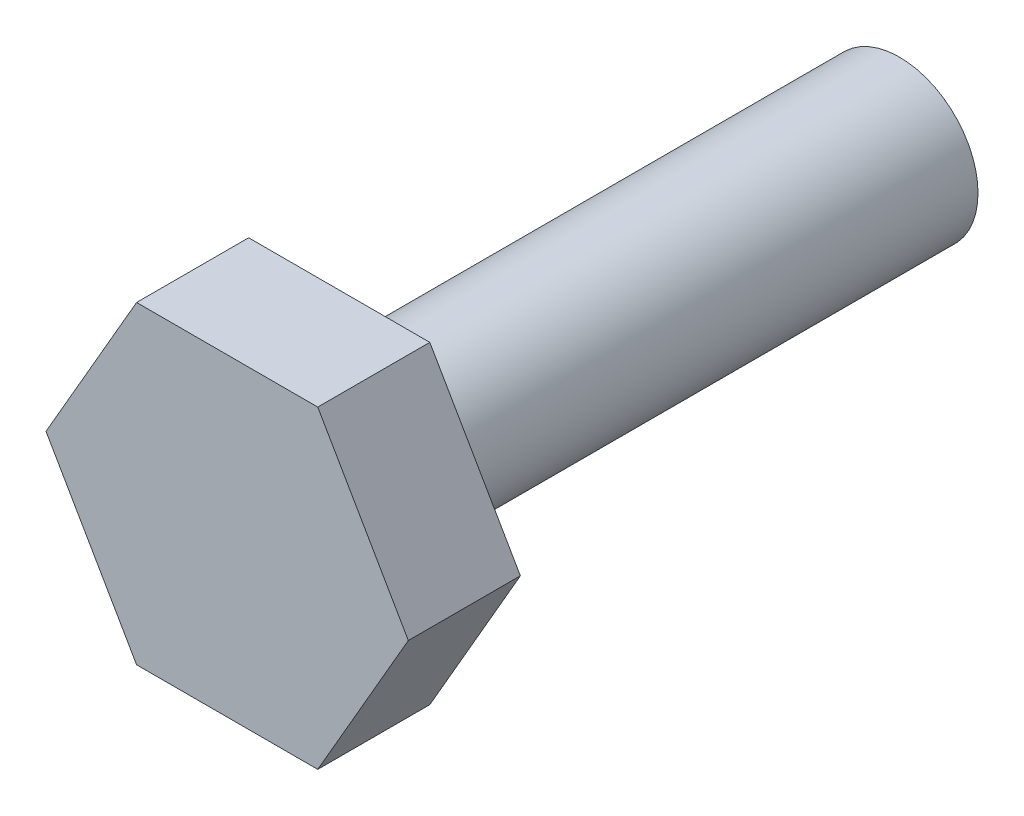
from build123d import *

# Parameters (mm, degrees)
BOSS_EXTRUDE1_DEPTH = 2.5
BOSS_EXTRUDE2_START = -12.5
SKETCH2_R           = 1.75
BOSS_EXTRUDE2_DEPTH = 12.5


with BuildPart() as part:
    # Sketch1 → Boss-Extrude1 (new body)
    with BuildSketch(Plane.XY):
        Polygon((4.041451884, 0), (2.020725942, 3.5), (-2.020725942, 3.5), (-4.041451884, 0), (-2.020725942, -3.5), (2.020725942, -3.5), align=None)
    extrude(amount=BOSS_EXTRUDE1_DEPTH)

    # Sketch2 → Boss-Extrude2 (add)
    with BuildSketch(Plane.XY.offset(BOSS_EXTRUDE2_START)):
        Circle(SKETCH2_R)
    extrude(amount=BOSS_EXTRUDE2_DEPTH)


solid = part.part
